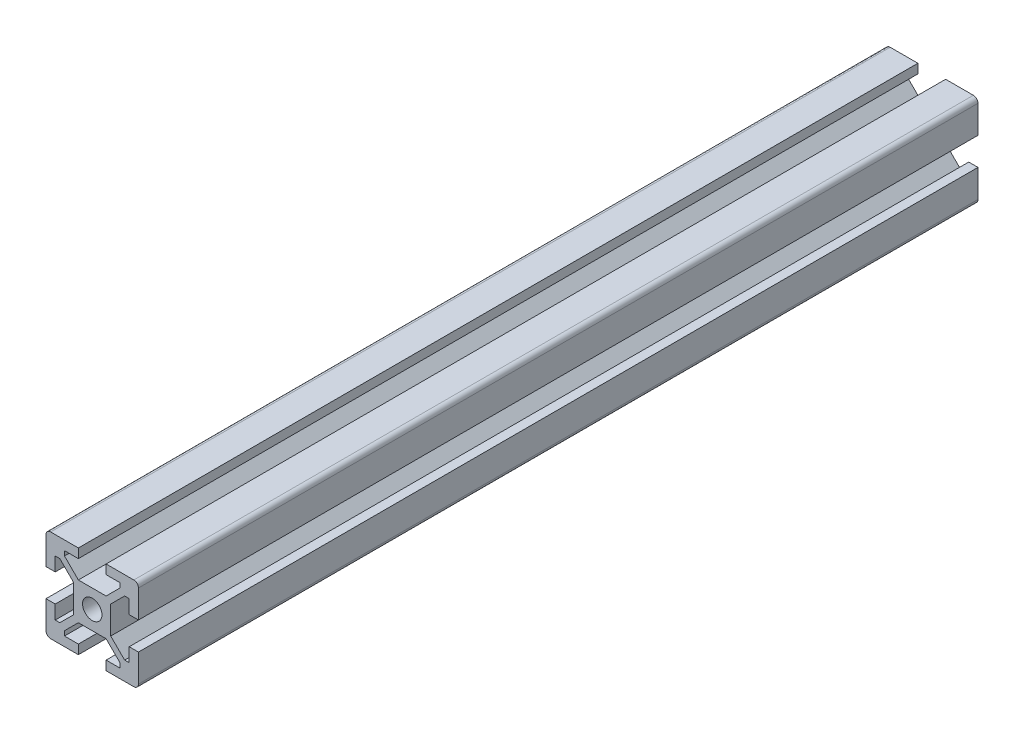
from build123d import *

# Parameters (mm, degrees)
SKETCH1_R           = 2.1
BOSS_EXTRUDE1_DEPTH = 181.575


with BuildPart() as part:
    # Sketch1 → Boss-Extrude1 (new body)
    with BuildSketch(Plane(origin=(0, 0, 0), x_dir=(-1, 0, 0), z_dir=(0, 0, -1))):
        with BuildLine():
            Line((6, -8), (3, -8))
            Line((3, -8), (3, -10))
            Line((3, -10), (9, -10))
            ThreePointArc((9, -10), (9.707106781, -9.707106781), (10, -9))
            Line((10, -9), (10, -3))
            Line((10, -3), (8, -3))
            Line((8, -3), (8, -6))
            Line((8, -6), (7, -6))
            Line((7, -6), (4, -3))
            Line((4, -3), (4, 3))
            Line((4, 3), (7, 6))
            Line((7, 6), (8, 6))
            Line((8, 6), (8, 3))
            Line((8, 3), (10, 3))
            Line((10, 3), (10, 9))
            ThreePointArc((10, 9), (9.707106781, 9.707106781), (9, 10))
            Line((9, 10), (3, 10))
            Line((3, 10), (3, 8))
            Line((3, 8), (6, 8))
            Line((6, 8), (6, 7))
            Line((6, 7), (3, 4))
            Line((3, 4), (-3, 4))
            Line((-3, 4), (-6, 7))
            Line((-6, 7), (-6, 8))
            Line((-6, 8), (-3, 8))
            Line((-3, 8), (-3, 10))
            Line((-3, 10), (-9, 10))
            ThreePointArc((-9, 10), (-9.707106781, 9.707106781), (-10, 9))
            Line((-10, 9), (-10, 3))
            Line((-10, 3), (-8, 3))
            Line((-8, 3), (-8, 6))
            Line((-8, 6), (-7, 6))
            Line((-7, 6), (-4, 3))
            Line((-4, 3), (-4, -3))
            Line((-4, -3), (-7, -6))
            Line((-7, -6), (-8, -6))
            Line((-8, -6), (-8, -3))
            Line((-8, -3), (-10, -3))
            Line((-10, -3), (-10, -9))
            ThreePointArc((-10, -9), (-9.707106781, -9.707106781), (-9, -10))
            Line((-9, -10), (-3, -10))
            Line((-3, -10), (-3, -8))
            Line((-3, -8), (-6, -8))
            Line((-6, -8), (-6, -7))
            Line((-6, -7), (-3, -4))
            Line((-3, -4), (3, -4))
            Line((3, -4), (6, -7))
            Line((6, -7), (6, -8))
        make_face()
        with Locations(Location((0, 0, 0), (0, 0, 180))):
            Circle(SKETCH1_R, mode=Mode.SUBTRACT)
    extrude(amount=-BOSS_EXTRUDE1_DEPTH)


solid = part.part
